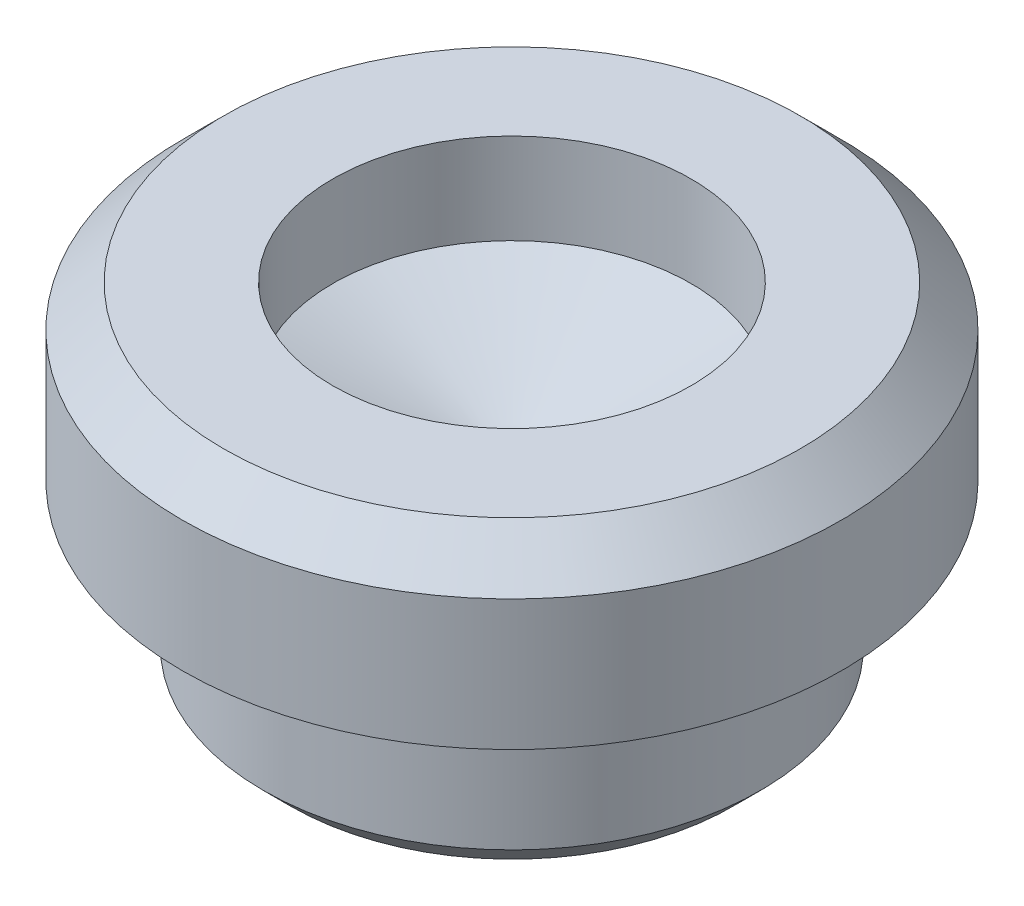
from build123d import *

# Parameters (mm, degrees)
SKETCH1_R           = 4.5974
BOSS_EXTRUDE1_DEPTH = 3.175
SKETCH2_R           = 6.096
BOSS_EXTRUDE2_DEPTH = 3.175
CHAMFER1_SIZE       = 0.762
CHAMFER2_SIZE       = 0.508
SKETCH3_R           = 3.3147
CUT_EXTRUDE1_DEPTH  = 1.6764


with BuildPart() as part:
    # Sketch1 → Boss-Extrude1 (new body)
    with BuildSketch(Plane(origin=(0, 0, 0), x_dir=(1, 0, 0), z_dir=(0, 1, 0))):
        with Locations(Location((0, 0, 0), (0, 0, 270))):
            Circle(SKETCH1_R)
    extrude(amount=BOSS_EXTRUDE1_DEPTH)

    # Sketch2 → Boss-Extrude2 (add)
    with BuildSketch(Plane(origin=(0, 3.175, 0), x_dir=(1, 0, 0), z_dir=(0, 1, 0))):
        with Locations(Location((0, 0, 0), (0, 0, 270))):
            Circle(SKETCH2_R)
    extrude(amount=BOSS_EXTRUDE2_DEPTH)

    # Chamfer1
    chamfer1_edges = [part.edges().sort_by_distance(p)[0] for p in [
        (0, 6.35, -6.096),
    ]]
    chamfer(chamfer1_edges, length=CHAMFER1_SIZE)

    # Chamfer2
    chamfer2_edges = [part.edges().sort_by_distance(p)[0] for p in [
        (0, 0, -4.5974),
    ]]
    chamfer(chamfer2_edges, length=CHAMFER2_SIZE)

    # Sketch3 → Cut-Extrude1 (cut)
    with BuildSketch(Plane(origin=(0, 6.35, 0), x_dir=(1, 0, 0), z_dir=(0, 1, 0))):
        with Locations(Location((0, 0, 0), (0, 0, 270))):
            Circle(SKETCH3_R)
    extrude(amount=-CUT_EXTRUDE1_DEPTH, mode=Mode.SUBTRACT)

    # Cut-Extrude2 cone 1 section (through the dimple's axis) → Cut-Extrude2 (revolve, cut)
    with BuildSketch(Plane(origin=(0, 4.6736, 0), x_dir=(0, 0, 1), z_dir=(1, 0, 0))):
        Polygon((0, 0), (3.3147, 0), (0, 1.339225731), align=None)
    revolve(axis=Axis((0, 4.6736, 0), (0, -1, 0)), mode=Mode.SUBTRACT)


solid = part.part
